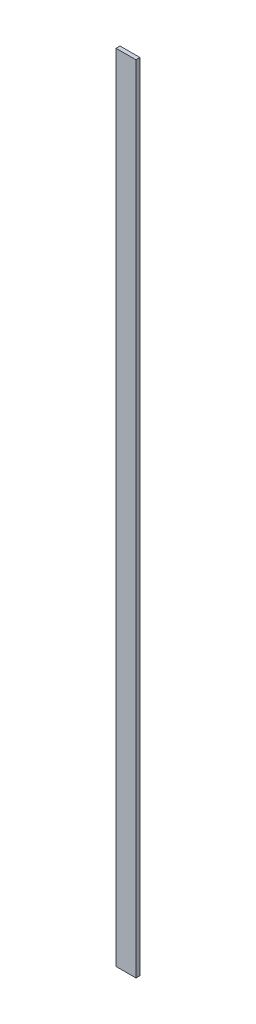
from build123d import *

# Parameters (mm, degrees)
SKETCH1_W           = 25
SKETCH1_H           = 1000
BOSS_EXTRUDE1_DEPTH = 2.5


with BuildPart() as part:
    # Sketch1 → Boss-Extrude1 (new, symmetric)
    with BuildSketch(Plane.XY):
        Rectangle(SKETCH1_W, SKETCH1_H)
    extrude(amount=BOSS_EXTRUDE1_DEPTH, both=True)


solid = part.part
